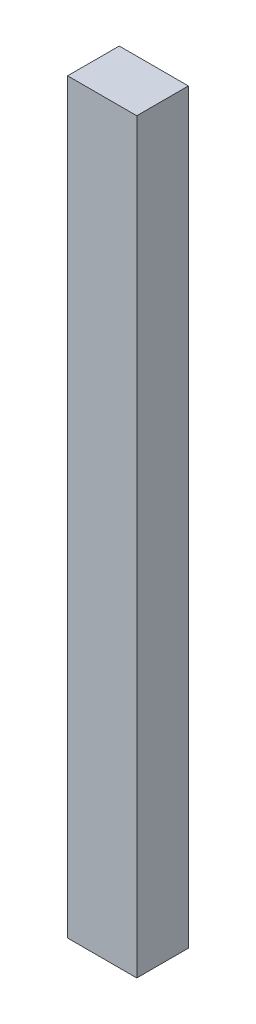
from build123d import *

# Parameters (mm, degrees)
SKETCH1_W           = 58.800188212
SKETCH1_H           = 43.904140532
BOSS_EXTRUDE1_DEPTH = 635


with BuildPart() as part:
    # Sketch1 → Boss-Extrude1 (new body)
    with BuildSketch(Plane(origin=(0, 0, 0), x_dir=(1, 0, 0), z_dir=(0, 1, 0))):
        with Locations((1.568005019, -2.548008156)):
            Rectangle(SKETCH1_W, SKETCH1_H)
    extrude(amount=BOSS_EXTRUDE1_DEPTH)


solid = part.part
